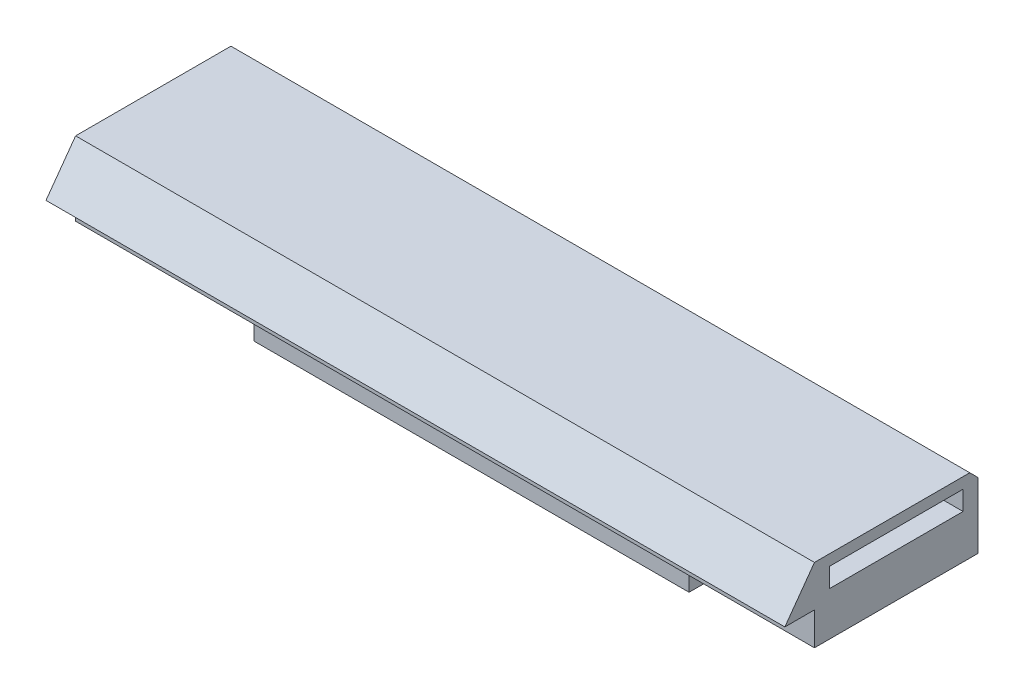
from build123d import *

# Parameters (mm, degrees)
SKETCH_1_W          = 8.99
SKETCH_1_H          = 1.99
EXTRUDE_1_DEPTH     = 1
EXTRUDE_2_DEPTH     = 8.99
SKETCH_3_W          = 1.62690844
SKETCH_3_H          = 0.234992706
CUT_EXTRUDE_2_DEPTH = 8.9
SKETCH_4_W          = 5.293711796
SKETCH_4_H          = 1.344910324
EXTRUDE_3_DEPTH     = 0.5
SKETCH_5_W          = 4.74668983
SKETCH_5_H          = 1.99
EXTRUDE_4_DEPTH     = 0.5
CHAMFER_1_SIZE      = 0.1
CHAMFER_2_SIZE      = 0.1


with BuildPart() as part:
    # 草图1 → 凸台-拉伸1 (new body)
    with BuildSketch(Plane(origin=(0, 0, 0), x_dir=(1, 0, 0), z_dir=(0, 1, 0))):
        Rectangle(SKETCH_1_W, SKETCH_1_H)
    extrude(amount=EXTRUDE_1_DEPTH)

    # 草图2 → 凸台-拉伸2 (add)
    with BuildSketch(Plane(origin=(4.495, 0, 0), x_dir=(0, 0, -1), z_dir=(1, 0, 0))):
        Polygon((-0.995, 0.5), (-1.355023595, 0.5), (-0.995, 1), align=None)
    extrude(amount=-EXTRUDE_2_DEPTH)

    # 草图3 → 切除-拉伸2 (cut)
    with BuildSketch(Plane(origin=(4.495, 0, 0), x_dir=(0, 0, -1), z_dir=(1, 0, 0))):
        with Locations((0, 0.75)):
            Rectangle(SKETCH_3_W, SKETCH_3_H)
    extrude(amount=-CUT_EXTRUDE_2_DEPTH, mode=Mode.SUBTRACT)

    # 草图4 → 凸台-拉伸3 (add)
    with BuildSketch(Plane.XZ):
        Rectangle(SKETCH_4_W, SKETCH_4_H)
    extrude(amount=EXTRUDE_3_DEPTH)

    # 草图5 → 凸台-拉伸4 (add)
    with BuildSketch(Plane(origin=(0, 1, 0), x_dir=(1, 0, 0), z_dir=(0, 1, 0))):
        Rectangle(SKETCH_5_W, SKETCH_5_H)
    extrude(amount=-EXTRUDE_4_DEPTH)

    # 倒角1
    chamfer_1_edges = [part.edges().sort_by_distance(p)[0] for p in [
        (2.646855898, 0, 0),
        (0, 0, 0.672455162),
        (-2.646855898, 0, 0),
        (0, 0, -0.672455162),
        (2.646855898, -0.5, 0),
        (0, -0.5, 0.672455162),
        (-2.646855898, -0.5, 0),
        (0, -0.5, -0.672455162),
        (0, 0, 0.995),
        (-4.495, 0, 0),
        (0, 0, -0.995),
        (4.495, 0, 0),
    ]]
    chamfer(chamfer_1_edges, length=CHAMFER_1_SIZE)

    # 倒角2
    chamfer_2_edges = [part.edges().sort_by_distance(p)[0] for p in [
        (0, 1, -0.995),
    ]]
    chamfer(chamfer_2_edges, length=CHAMFER_2_SIZE)


solid = part.part
